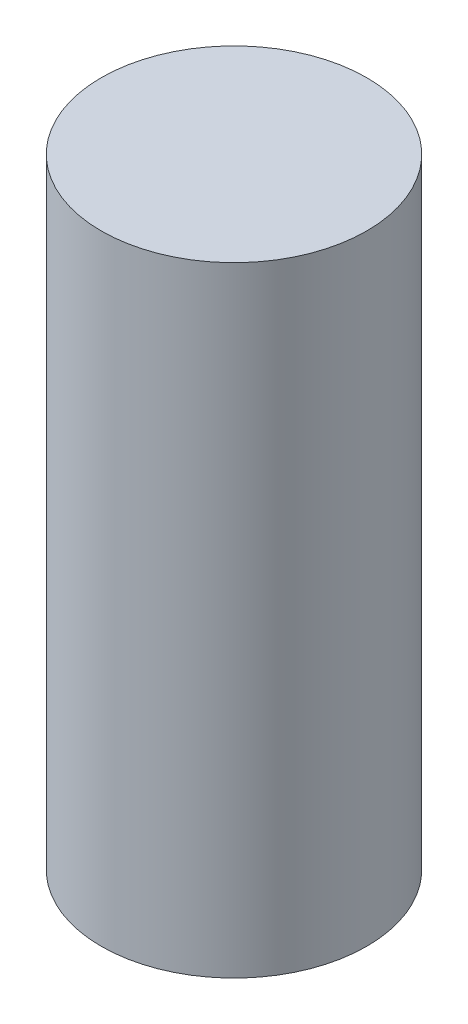
from build123d import *

# Parameters (mm, degrees)
OVEN_AYAR_MIL_3_START = 12
SKETCH1_R             = 6
OVEN_AYAR_MIL_3_DEPTH = 28


with BuildPart() as part:
    # Sketch1 → OVEN_ayar_mil_3 (new body)
    with BuildSketch(Plane(origin=(0, 0, 0), x_dir=(1, 0, 0), z_dir=(0, 1, 0)).offset(OVEN_AYAR_MIL_3_START)):
        with Locations(Location((50, 770, 0), (0, 0, 270))):
            Circle(SKETCH1_R)
    extrude(amount=OVEN_AYAR_MIL_3_DEPTH)


solid = part.part
